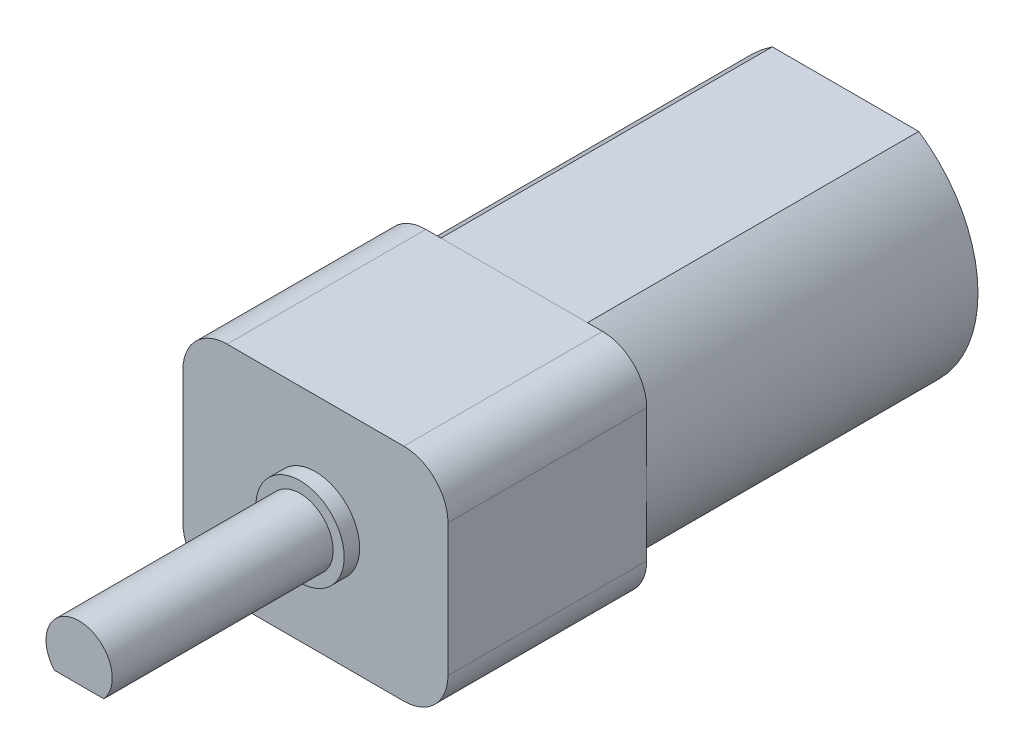
from build123d import *

# Parameters (mm, degrees)
EXTRUDE_406_DEPTH      = 15
SKETCH2_R              = 2.5
EXTRUDE_567_DEPTH      = 1.2
SKETCH5_W              = 12
SKETCH5_H              = 10
EXTRUDE_774_DEPTH      = 9
FILLET_814_R           = 2
SKETCH6_R              = 2
EXTRUDE_1143_DEPTH     = 0.7
SKETCH7_R              = 1.5
EXTRUDE_1228_DEPTH     = 10
CUT_EXTRUDE_1344_DEPTH = 10


with BuildPart() as part:
    # Sketch9 → Extrude 406 (new body)
    with BuildSketch(Plane.XY):
        with BuildLine():
            Line((-3.31662479, 5), (3.31662479, 5))
            ThreePointArc((3.31662479, 5), (6, 0), (3.31662479, -5))
            Line((3.31662479, -5), (-3.31662479, -5))
            ThreePointArc((-3.31662479, -5), (-6, 0), (-3.31662479, 5))
        make_face()
    extrude(amount=EXTRUDE_406_DEPTH)

    # Sketch2 → Extrude 567 (add)
    with BuildSketch(Plane(origin=(0, 0, 0), x_dir=(-1, 0, 0), z_dir=(0, 0, -1))):
        Circle(SKETCH2_R)
    extrude(amount=EXTRUDE_567_DEPTH)


with BuildPart() as body_2:
    # Sketch5 → Extrude 774 (new body)
    with BuildSketch(Plane.XY.offset(15)):
        Rectangle(SKETCH5_W, SKETCH5_H)
    extrude(amount=EXTRUDE_774_DEPTH)

    # Fillet 814
    fillet_814_edges = [body_2.edges().sort_by_distance(p)[0] for p in [
        (6, -5, 19.5),
        (-6, -5, 19.5),
        (-6, 5, 19.5),
        (6, 5, 19.5),
    ]]
    fillet(fillet_814_edges, radius=FILLET_814_R)

    # Sketch6 → Extrude 1143 (add)
    with BuildSketch(Plane.XY.offset(24)):
        Circle(SKETCH6_R)
    extrude(amount=EXTRUDE_1143_DEPTH)

    # Sketch7 → Extrude 1228 (add)
    with BuildSketch(Plane.XY.offset(24.7)):
        Circle(SKETCH7_R)
    extrude(amount=EXTRUDE_1228_DEPTH)

    # Sketch8 → Cut-Extrude 1344 (cut)
    with BuildSketch(Plane.XY.offset(34.7)):
        with BuildLine():
            Line((-1.118033989, -1), (1.118033989, -1))
            ThreePointArc((1.118033989, -1), (0, -1.5), (-1.118033989, -1))
        make_face()
    extrude(amount=-CUT_EXTRUDE_1344_DEPTH, mode=Mode.SUBTRACT)


solid = Compound([part.part, body_2.part])
